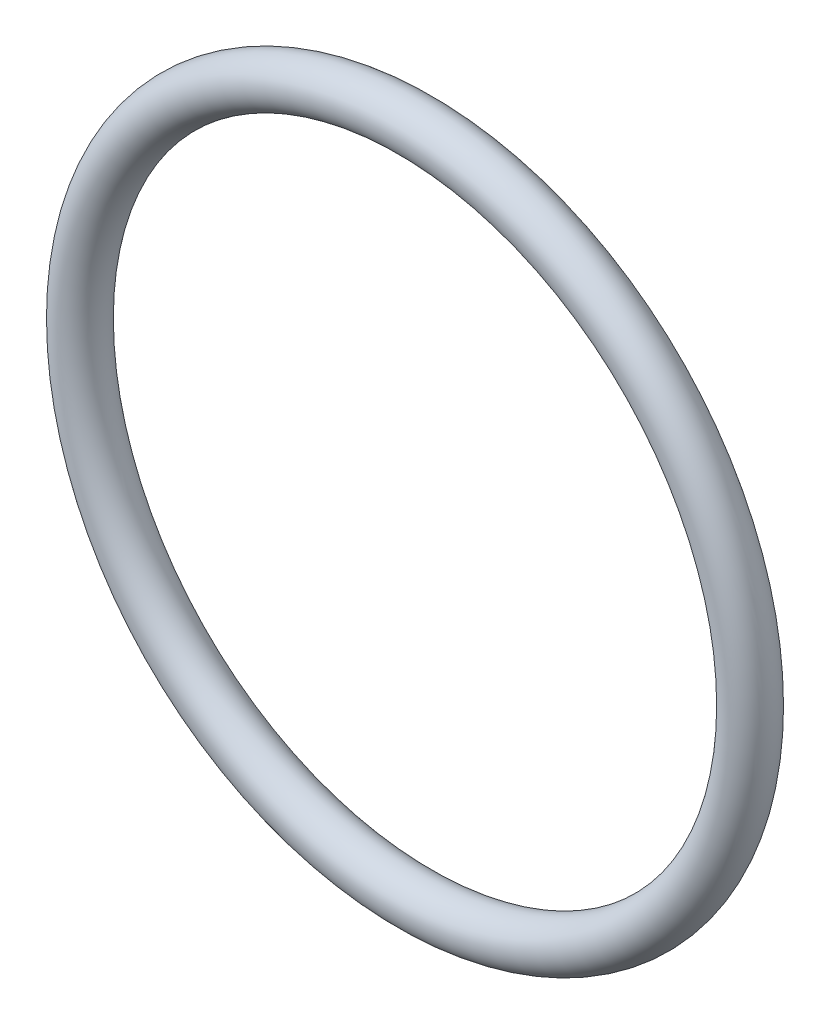
from build123d import *

# Parameters (mm, degrees)
SWEEP_1_PROFILE_R = 0.6


with BuildPart() as part:
    # 扫描1: sweep along a path in 草图1
    with BuildLine(Plane.XY) as sweep_1_path:
        CenterArc((0, 0), 8.5, 0, 360)
    # 扫描1 profile (on start of the path) → 扫描1 (sweep)
    with BuildSketch(Plane(origin=(8.5, 0, 0), x_dir=(0, 0, 1), z_dir=(0, 1, 0))):
        Circle(SWEEP_1_PROFILE_R)
    sweep(path=sweep_1_path.line)


solid = part.part
